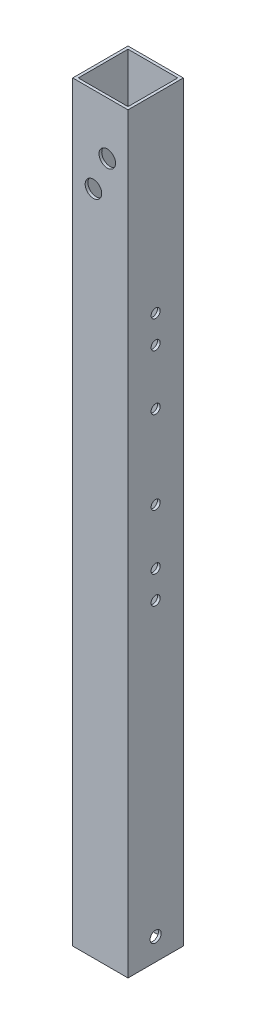
from build123d import *

# Parameters (mm, degrees)
SKETCH_1_W          = 20
SKETCH_1_H          = 20
SKETCH_1_W_2        = 18
SKETCH_1_H_2        = 18
EXTRUDE_1_DEPTH     = 136
SKETCH_2_R          = 3
CUT_EXTRUDE_1_DEPTH = 200
SKETCH_3_R          = 2
SKETCH_3_R_2        = 1.65
CUT_EXTRUDE_2_DEPTH = 138.825977232


with BuildPart() as part:
    # 草图1 → 凸台-拉伸1 (new, symmetric)
    with BuildSketch(Plane(origin=(0, 0, 0), x_dir=(1, 0, 0), z_dir=(0, 1, 0))):
        Rectangle(SKETCH_1_W, SKETCH_1_H)
        Rectangle(SKETCH_1_W_2, SKETCH_1_H_2, mode=Mode.SUBTRACT)
    extrude(amount=EXTRUDE_1_DEPTH, both=True)

    # 草图2 → 切除-拉伸1 (cut)
    with BuildSketch(Plane.XY.offset(10)):
        with Locations((-2.5, 105)):
            Circle(SKETCH_2_R)
        with Locations((2.5, 117)):
            Circle(SKETCH_2_R)
    extrude(amount=-CUT_EXTRUDE_1_DEPTH, mode=Mode.SUBTRACT)

    # 草图3 → 切除-拉伸2 (cut, through all)
    with BuildSketch(Plane.ZY.offset(10)):
        with Locations((0, -128)):
            Circle(SKETCH_3_R)
        with Locations((0, 57.2863231)):
            Circle(SKETCH_3_R_2)
        with Locations((0, 67.2863231)):
            Circle(SKETCH_3_R_2)
        with Locations((0, -12.7136769)):
            Circle(SKETCH_3_R_2)
        with Locations((0, -22.7136769)):
            Circle(SKETCH_3_R_2)
        with Locations((0, 37.2863231)):
            Circle(SKETCH_3_R_2)
        with Locations((0, 7.2863231)):
            Circle(SKETCH_3_R_2)
    extrude(amount=-CUT_EXTRUDE_2_DEPTH, mode=Mode.SUBTRACT)


solid = part.part
